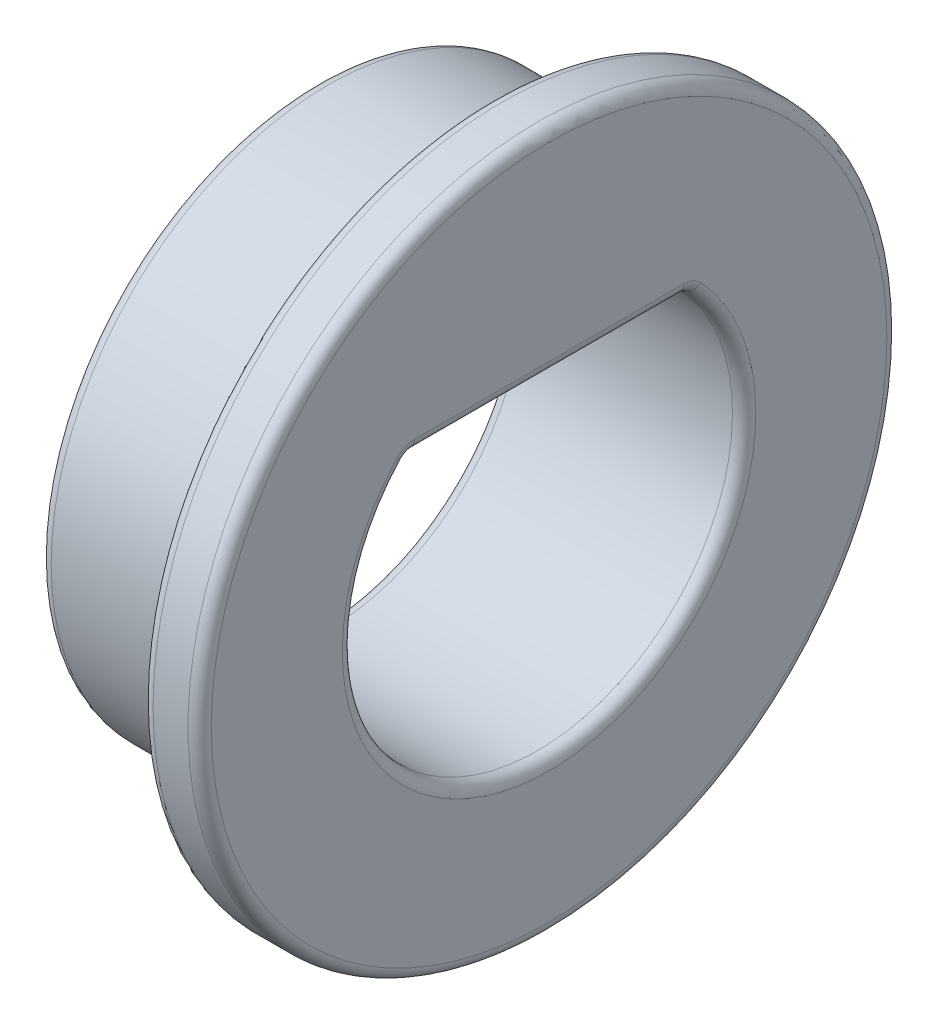
from build123d import *

# Parameters (mm, degrees)
CUT_EXTRUDE1_REACH = 11.381
FILLET1_R          = 0.2


with BuildPart() as part:
    # Sketch1 → Revolve1 (revolve)
    with BuildSketch(Plane.XY, mode=Mode.PRIVATE) as revolve1_sk:
        Polygon((-4, 0), (-4, 4.75), (-1, 4.75), (-1, 6), (0, 6), (0, 0), align=None)
    revolve(revolve1_sk.sketch.rotate(Axis((0, 0, 0), (-1, 0, 0)), 90), axis=Axis((0, 0, 0), (-1, 0, 0)))

    # Sketch2 → Cut-Extrude1 (cut, up to next)
    with BuildSketch(Plane(origin=(0, 0, 0), x_dir=(0, 0, -1), z_dir=(1, 0, 0)), mode=Mode.PRIVATE) as cut_extrude1_sk1:
        with BuildLine():
            Line((-2.4, 2.337199179), (2.4, 2.337199179))
            ThreePointArc((2.4, 2.337199179), (0, -3.35), (-2.4, 2.337199179))
        make_face()
    cut_extrude1_tool1 = extrude(cut_extrude1_sk1.sketch, amount=-CUT_EXTRUDE1_REACH, mode=Mode.PRIVATE) & part.part
    add(cut_extrude1_tool1.solids().sort_by_distance((0, -0.288877, 0))[0], mode=Mode.SUBTRACT)

    # Fillet1
    fillet1_edges = [part.edges().sort_by_distance(p)[0] for p in [
        (-4, -3.35, 0),
        (-2, 2.337199179, -2.4),
        (-4, 2.337199179, 0),
        (-2, 2.337199179, 2.4),
        (0, -3.35, 0),
        (0, 2.337199179, 0),
        (0, 0, 6),
        (-1, 0, 6),
        (-1, 0, 4.75),
        (-4, 0, 4.75),
    ]]
    fillet(fillet1_edges, radius=FILLET1_R)


solid = part.part
